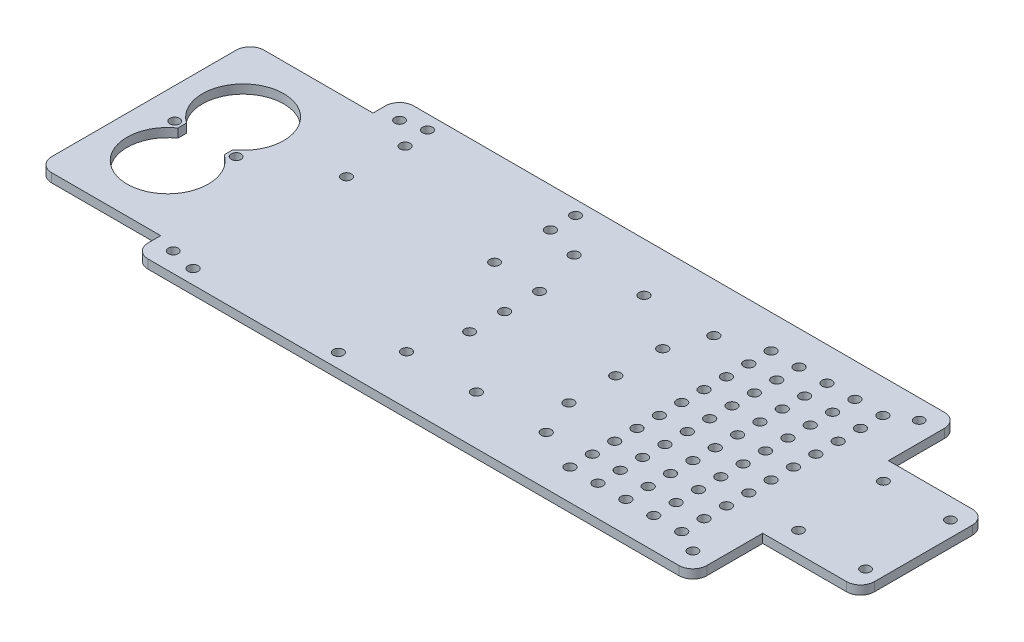
from build123d import *

# Parameters (mm, degrees)
SKETCH1_W           = 200
SKETCH1_H           = 95
BOSS_EXTRUDE1_DEPTH = 3.175
SKETCH3_R           = 1.75
CUT_EXTRUDE2_DEPTH  = 118.785400915
SKETCH4_W           = 76
SKETCH4_H           = 3.175
BOSS_EXTRUDE2_DEPTH = 44
SKETCH5_R           = 1.75
CUT_EXTRUDE3_DEPTH  = 148.223024992
SKETCH7_W           = 45
SKETCH7_H           = 3.175
BOSS_EXTRUDE3_DEPTH = 35
SKETCH8_R           = 1.75
CUT_EXTRUDE4_DEPTH  = 151.064564226
FILLET1_R           = 5
SKETCH9_R           = 1.775
CUT_EXTRUDE5_DEPTH  = 151.064564226
SKETCH10_R          = 1.8
SKETCH10_R_2        = 1.775
CUT_EXTRUDE6_DEPTH  = 151.064564226
SKETCH11_R          = 1.8
CUT_EXTRUDE7_DEPTH  = 151.064564226
SKETCH12_R          = 1.8
CUT_EXTRUDE8_DEPTH  = 151.064564226


with BuildPart() as part:
    # Sketch1 → Boss-Extrude1 (new body)
    with BuildSketch(Plane(origin=(0, 0, 0), x_dir=(1, 0, 0), z_dir=(0, 1, 0))):
        with Locations((6.013896682, 3.728641929)):
            Rectangle(SKETCH1_W, SKETCH1_H)
    extrude(amount=BOSS_EXTRUDE1_DEPTH)

    # Sketch3 → Cut-Extrude2 (cut, through all)
    with BuildSketch(Plane(origin=(0, 3.175, 0), x_dir=(1, 0, 0), z_dir=(0, 1, 0))):
        with Locations(Location((-86.986103318, -36.771358071, 0), (0, 0, 270))):
            Circle(SKETCH3_R)
        with Locations(Location((-86.986103318, 44.228641929, 0), (0, 0, 270))):
            Circle(SKETCH3_R)
        with Locations(Location((99.013896682, 44.228641929, 0), (0, 0, 270))):
            Circle(SKETCH3_R)
        with Locations(Location((99.013896682, -36.771358071, 0), (0, 0, 270))):
            Circle(SKETCH3_R)
    extrude(amount=-CUT_EXTRUDE2_DEPTH, mode=Mode.SUBTRACT)

    # Sketch4 → Boss-Extrude2 (add)
    with BuildSketch(Plane.ZY.offset(93.986103318)):
        with Locations((-3.728641929, 1.5875)):
            Rectangle(SKETCH4_W, SKETCH4_H)
    extrude(amount=BOSS_EXTRUDE2_DEPTH)

    # Sketch5 → Cut-Extrude3 (cut, through all)
    with BuildSketch(Plane(origin=(0, 3.175, 0), x_dir=(1, 0, 0), z_dir=(0, 1, 0))):
        with Locations(Location((-126.986103318, 3.728641929, 0), (0, 0, 270))):
            Circle(SKETCH5_R)
        with Locations(Location((-104.986103318, 3.728641929, 0), (0, 0, 270))):
            Circle(SKETCH5_R)
        with BuildLine():
            Line((-124.286103318, 2.179060332), (-124.286103318, 5.278223526))
            ThreePointArc((-124.286103318, 5.278223526), (-115.986103318, 31.778641929), (-107.686103318, 5.278223526))
            Line((-107.686103318, 5.278223526), (-107.686103318, 2.179060332))
            ThreePointArc((-107.686103318, 2.179060332), (-115.986103318, -24.321358071), (-124.286103318, 2.179060332))
        make_face()
    extrude(amount=-CUT_EXTRUDE3_DEPTH, mode=Mode.SUBTRACT)

    # Sketch7 → Boss-Extrude3 (add)
    with BuildSketch(Plane(origin=(106.013896682, 0, 0), x_dir=(0, 0, -1), z_dir=(1, 0, 0))):
        with Locations((3.728641929, 1.5875)):
            Rectangle(SKETCH7_W, SKETCH7_H)
    extrude(amount=BOSS_EXTRUDE3_DEPTH)

    # Sketch8 → Cut-Extrude4 (cut, through all)
    with BuildSketch(Plane(origin=(0, 3.175, 0), x_dir=(1, 0, 0), z_dir=(0, 1, 0))):
        with Locations(Location((111.513896682, -11.471358071, 0), (0, 0, 270))):
            Circle(SKETCH8_R)
        with Locations(Location((111.513896682, 18.928641929, 0), (0, 0, 270))):
            Circle(SKETCH8_R)
        with Locations(Location((135.513896682, -11.471358071, 0), (0, 0, 270))):
            Circle(SKETCH8_R)
        with Locations(Location((135.513896682, 18.928641929, 0), (0, 0, 270))):
            Circle(SKETCH8_R)
    extrude(amount=-CUT_EXTRUDE4_DEPTH, mode=Mode.SUBTRACT)

    # Fillet1
    fillet1_edges = [part.edges().sort_by_distance(p)[0] for p in [
        (106.013896682, 1.5875, -51.228641929),
        (141.013896682, 1.5875, -26.228641929),
        (141.013896682, 1.5875, 18.771358071),
        (106.013896682, 1.5875, 43.771358071),
        (-93.986103318, 1.5875, -51.228641929),
        (-93.986103318, 1.5875, 43.771358071),
        (-137.986103318, 1.5875, -41.728641929),
        (-137.986103318, 1.5875, 34.271358071),
    ]]
    fillet(fillet1_edges, radius=FILLET1_R)

    # Sketch9 → Cut-Extrude5 (cut, through all)
    with BuildSketch(Plane(origin=(0, 3.175, 0), x_dir=(1, 0, 0), z_dir=(0, 1, 0))):
        with Locations(Location((-78.986103318, 46.228641929, 0), (0, 0, 270))):
            Circle(SKETCH9_R)
        with Locations(Location((-25.986103318, 46.228641929, 0), (0, 0, 270))):
            Circle(SKETCH9_R)
        with Locations(Location((-25.986103318, 17.228641929, 0), (0, 0, 270))):
            Circle(SKETCH9_R)
        with Locations(Location((-78.986103318, 17.228641929, 0), (0, 0, 270))):
            Circle(SKETCH9_R)
    extrude(amount=-CUT_EXTRUDE5_DEPTH, mode=Mode.SUBTRACT)

    # Sketch10 → Cut-Extrude6 (cut, through all)
    with BuildSketch(Plane(origin=(0, 3.175, 0), x_dir=(1, 0, 0), z_dir=(0, 1, 0))):
        with Locations(Location((-13.986103318, 33.728641929, 0), (0, 0, 270))):
            Circle(SKETCH10_R)
        with Locations(Location((11.013896682, 33.728641929, 0), (0, 0, 270))):
            Circle(SKETCH10_R)
        with Locations(Location((36.013896682, 33.728641929, 0), (0, 0, 270))):
            Circle(SKETCH10_R)
        with Locations(Location((-13.986103318, -26.271358071, 0), (0, 0, 270))):
            Circle(SKETCH10_R)
        with Locations(Location((11.013896682, -26.271358071, 0), (0, 0, 270))):
            Circle(SKETCH10_R)
        with Locations(Location((36.013896682, -26.271358071, 0), (0, 0, 270))):
            Circle(SKETCH10_R)
        with Locations(Location((-8.886103318, 3.728641929, 0), (0, 0, 270))):
            Circle(SKETCH10_R)
        with Locations(Location((30.913896682, 3.728641929, 0), (0, 0, 270))):
            Circle(SKETCH10_R)
        with Locations(Location((-8.886103318, 16.228641929, 0), (0, 0, 270))):
            Circle(SKETCH10_R_2)
        with Locations(Location((-8.886103318, -8.771358071, 0), (0, 0, 270))):
            Circle(SKETCH10_R_2)
        with Locations(Location((30.913896682, -13.071358071, 0), (0, 0, 270))):
            Circle(SKETCH10_R)
        with Locations(Location((30.913896682, 20.528641929, 0), (0, 0, 270))):
            Circle(SKETCH10_R)
    extrude(amount=-CUT_EXTRUDE6_DEPTH, mode=Mode.SUBTRACT)

    # Sketch11 → Cut-Extrude7 (cut, through all)
    with BuildSketch(Plane(origin=(0, 3.175, 0), x_dir=(1, 0, 0), z_dir=(0, 1, 0))):
        with Locations(Location((-77.986103318, 37.228641929, 0), (0, 0, 270))):
            Circle(SKETCH11_R)
        with Locations(Location((-25.986103318, 37.228641929, 0), (0, 0, 270))):
            Circle(SKETCH11_R)
        with Locations(Location((-77.986103318, -38.671358071, 0), (0, 0, 270))):
            Circle(SKETCH11_R)
        with Locations(Location((-25.986103318, -38.671358071, 0), (0, 0, 270))):
            Circle(SKETCH11_R)
    extrude(amount=-CUT_EXTRUDE7_DEPTH, mode=Mode.SUBTRACT)

    # Sketch12 → Cut-Extrude8 (cut, through all)
    with BuildSketch(Plane(origin=(0, 3.175, 0), x_dir=(1, 0, 0), z_dir=(0, 1, 0))):
        with Locations(Location((51.013896682, 39.228641929, 0), (0, 0, 270))):
            Circle(SKETCH12_R)
        with Locations(Location((51.013896682, 31.228641929, 0), (0, 0, 270))):
            Circle(SKETCH12_R)
        with Locations(Location((51.013896682, 23.228641929, 0), (0, 0, 270))):
            Circle(SKETCH12_R)
        with Locations(Location((51.013896682, 15.228641929, 0), (0, 0, 270))):
            Circle(SKETCH12_R)
        with Locations(Location((51.013896682, 7.228641929, 0), (0, 0, 270))):
            Circle(SKETCH12_R)
        with Locations(Location((51.013896682, -0.771358071, 0), (0, 0, 270))):
            Circle(SKETCH12_R)
        with Locations(Location((51.013896682, -8.771358071, 0), (0, 0, 270))):
            Circle(SKETCH12_R)
        with Locations(Location((51.013896682, -16.771358071, 0), (0, 0, 270))):
            Circle(SKETCH12_R)
        with Locations(Location((51.013896682, -24.771358071, 0), (0, 0, 270))):
            Circle(SKETCH12_R)
        with Locations(Location((51.013896682, -32.771358071, 0), (0, 0, 270))):
            Circle(SKETCH12_R)
        with Locations(Location((61.013896682, 31.228641929, 0), (0, 0, 270))):
            Circle(SKETCH12_R)
        with Locations(Location((61.013896682, 23.228641929, 0), (0, 0, 270))):
            Circle(SKETCH12_R)
        with Locations(Location((61.013896682, 15.228641929, 0), (0, 0, 270))):
            Circle(SKETCH12_R)
        with Locations(Location((61.013896682, 7.228641929, 0), (0, 0, 270))):
            Circle(SKETCH12_R)
        with Locations(Location((61.013896682, -0.771358071, 0), (0, 0, 270))):
            Circle(SKETCH12_R)
        with Locations(Location((61.013896682, -8.771358071, 0), (0, 0, 270))):
            Circle(SKETCH12_R)
        with Locations(Location((61.013896682, -16.771358071, 0), (0, 0, 270))):
            Circle(SKETCH12_R)
        with Locations(Location((61.013896682, -24.771358071, 0), (0, 0, 270))):
            Circle(SKETCH12_R)
        with Locations(Location((61.013896682, -32.771358071, 0), (0, 0, 270))):
            Circle(SKETCH12_R)
        with Locations(Location((71.013896682, 31.228641929, 0), (0, 0, 270))):
            Circle(SKETCH12_R)
        with Locations(Location((71.013896682, 23.228641929, 0), (0, 0, 270))):
            Circle(SKETCH12_R)
        with Locations(Location((71.013896682, 15.228641929, 0), (0, 0, 270))):
            Circle(SKETCH12_R)
        with Locations(Location((71.013896682, 7.228641929, 0), (0, 0, 270))):
            Circle(SKETCH12_R)
        with Locations(Location((71.013896682, -0.771358071, 0), (0, 0, 270))):
            Circle(SKETCH12_R)
        with Locations(Location((71.013896682, -8.771358071, 0), (0, 0, 270))):
            Circle(SKETCH12_R)
        with Locations(Location((71.013896682, -16.771358071, 0), (0, 0, 270))):
            Circle(SKETCH12_R)
        with Locations(Location((71.013896682, -24.771358071, 0), (0, 0, 270))):
            Circle(SKETCH12_R)
        with Locations(Location((71.013896682, -32.771358071, 0), (0, 0, 270))):
            Circle(SKETCH12_R)
        with Locations(Location((81.013896682, 31.228641929, 0), (0, 0, 270))):
            Circle(SKETCH12_R)
        with Locations(Location((81.013896682, 23.228641929, 0), (0, 0, 270))):
            Circle(SKETCH12_R)
        with Locations(Location((81.013896682, 15.228641929, 0), (0, 0, 270))):
            Circle(SKETCH12_R)
        with Locations(Location((81.013896682, 7.228641929, 0), (0, 0, 270))):
            Circle(SKETCH12_R)
        with Locations(Location((81.013896682, -0.771358071, 0), (0, 0, 270))):
            Circle(SKETCH12_R)
        with Locations(Location((81.013896682, -8.771358071, 0), (0, 0, 270))):
            Circle(SKETCH12_R)
        with Locations(Location((81.013896682, -16.771358071, 0), (0, 0, 270))):
            Circle(SKETCH12_R)
        with Locations(Location((81.013896682, -24.771358071, 0), (0, 0, 270))):
            Circle(SKETCH12_R)
        with Locations(Location((81.013896682, -32.771358071, 0), (0, 0, 270))):
            Circle(SKETCH12_R)
        with Locations(Location((91.013896682, 31.228641929, 0), (0, 0, 270))):
            Circle(SKETCH12_R)
        with Locations(Location((91.013896682, 23.228641929, 0), (0, 0, 270))):
            Circle(SKETCH12_R)
        with Locations(Location((91.013896682, 15.228641929, 0), (0, 0, 270))):
            Circle(SKETCH12_R)
        with Locations(Location((91.013896682, 7.228641929, 0), (0, 0, 270))):
            Circle(SKETCH12_R)
        with Locations(Location((91.013896682, -0.771358071, 0), (0, 0, 270))):
            Circle(SKETCH12_R)
        with Locations(Location((91.013896682, -8.771358071, 0), (0, 0, 270))):
            Circle(SKETCH12_R)
        with Locations(Location((91.013896682, -16.771358071, 0), (0, 0, 270))):
            Circle(SKETCH12_R)
        with Locations(Location((91.013896682, -24.771358071, 0), (0, 0, 270))):
            Circle(SKETCH12_R)
        with Locations(Location((91.013896682, -32.771358071, 0), (0, 0, 270))):
            Circle(SKETCH12_R)
        with Locations(Location((61.013896682, 39.228641929, 0), (0, 0, 270))):
            Circle(SKETCH12_R)
        with Locations(Location((71.013896682, 39.228641929, 0), (0, 0, 270))):
            Circle(SKETCH12_R)
        with Locations(Location((81.013896682, 39.228641929, 0), (0, 0, 270))):
            Circle(SKETCH12_R)
        with Locations(Location((91.013896682, 39.228641929, 0), (0, 0, 270))):
            Circle(SKETCH12_R)
    extrude(amount=-CUT_EXTRUDE8_DEPTH, mode=Mode.SUBTRACT)


solid = part.part
